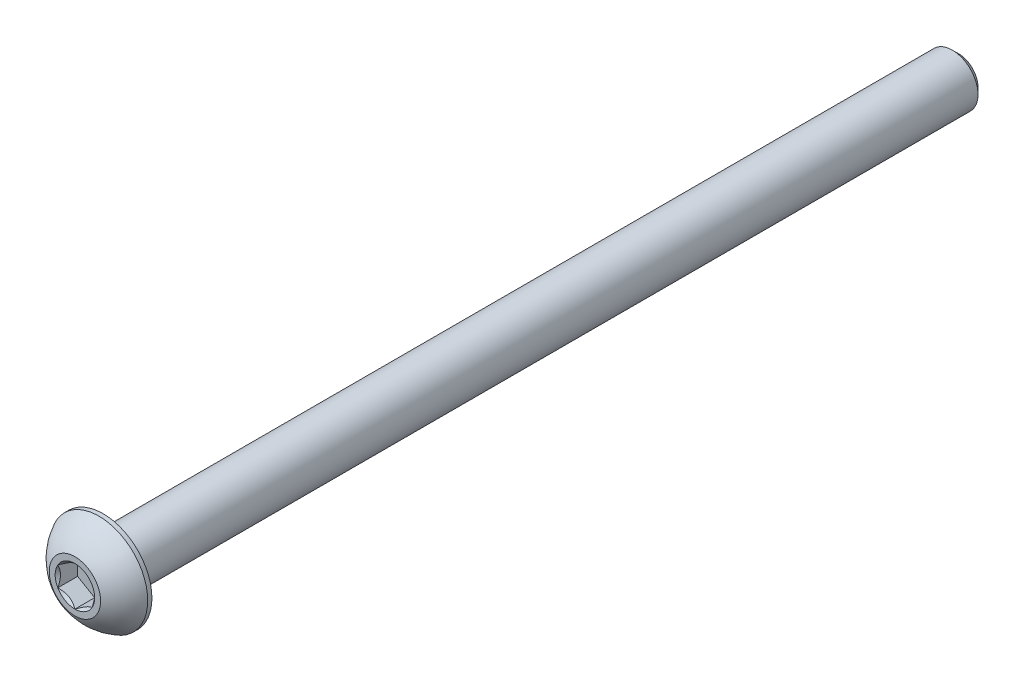
from build123d import *

# Parameters (mm, degrees)
CUT_EXTRUDE2_DEPTH = 1.155


with BuildPart() as part:
    # Sketch10 → Revolve3 (revolve)
    with BuildSketch(Plane(origin=(0, 0, 0), x_dir=(0, 0, -1), z_dir=(1, 0, 0))):
        Polygon((51.275, 1.5), (51.65, 1.125), (51.65, 0), (1.65, 0), (1.65, 1.5), align=None)
    revolve(axis=Axis((0, 0, 0), (0, 0, -1)))

    # Sketch7 → Revolve2 (revolve)
    with BuildSketch(Plane(origin=(0, 0, 0), x_dir=(0, 0, -1), z_dir=(1, 0, 0))):
        with BuildLine():
            Line((1.4025, 2.85), (1.65, 2.85))
            Line((1.65, 2.85), (1.65, 0))
            Line((1.65, 0), (0, 0))
            Line((0, 0), (0, 1.5))
            ThreePointArc((0, 1.5), (0.59512511, 2.285251969), (1.4025, 2.85))
        make_face()
    revolve(axis=Axis((0, 0, 0), (0, 0, -1)))

    # Sketch5 → Cut-Extrude2 (cut)
    with BuildSketch(Plane.XY):
        Polygon((1, -0.577350269), (1, 0.577350269), (0, 1.154700538), (-1, 0.577350269), (-1, -0.577350269), (0, -1.154700538), align=None)
    extrude(amount=-CUT_EXTRUDE2_DEPTH, mode=Mode.SUBTRACT)

    # Cut-Extrude3 cone 1 section (through the dimple's axis) → Cut-Extrude3 (revolve, cut)
    with BuildSketch(Plane(origin=(0, 0, 0), x_dir=(0, -1, 0), z_dir=(1, 0, 0))):
        Polygon((0, 0), (1.154700538, 0), (0, 1.154700538), align=None)
    revolve(axis=Axis((0, 0, 0), (0, 0, -1)), mode=Mode.SUBTRACT)


solid = part.part
